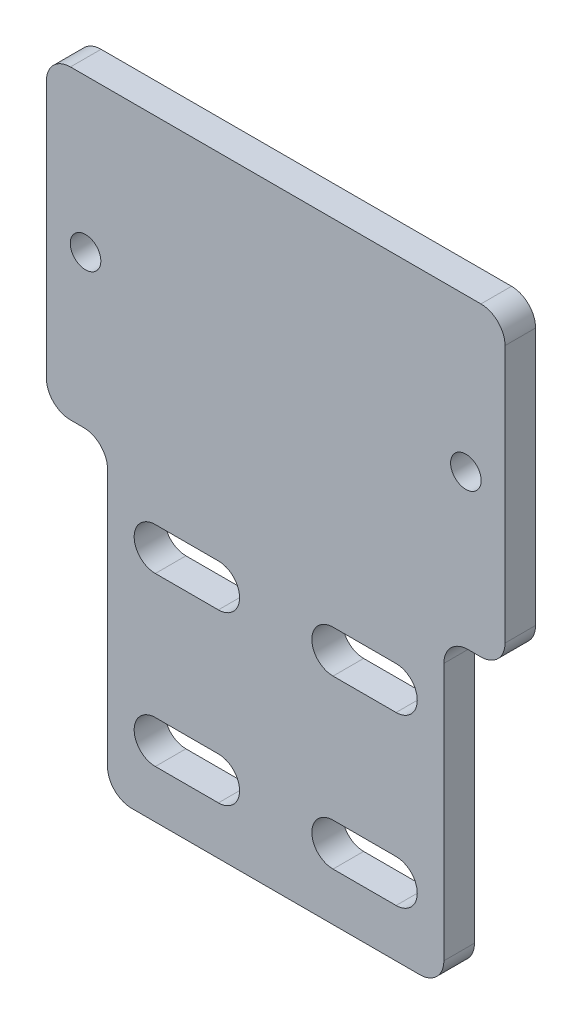
from build123d import *

# Parameters (mm, degrees)
BOSS_EXTRUDE1_DEPTH = 6.35
CUT_EXTRUDE1_REACH  = 153.604
SKETCH2_R           = 3.175
CUT_EXTRUDE2_REACH  = 153.604
FILLET1_R           = 5


with BuildPart() as part:
    # Sketch1 → Boss-Extrude1 (new body)
    with BuildSketch(Plane.XY):
        Polygon((0, 0), (0, 63.5), (-12.7, 63.5), (-12.7, 127), (82.55, 127), (82.55, 63.5), (69.85, 63.5), (69.85, 0), align=None)
    extrude(amount=BOSS_EXTRUDE1_DEPTH)

    # Sketch2 → Cut-Extrude1 (cut, up to next)
    with BuildSketch(Plane.XY.offset(6.35), mode=Mode.PRIVATE) as cut_extrude1_sk1:
        with Locations((-4.572, 95.25)):
            Circle(SKETCH2_R)
    cut_extrude1_tool1 = extrude(cut_extrude1_sk1.sketch, amount=-CUT_EXTRUDE1_REACH, mode=Mode.PRIVATE) & part.part
    # Sketch2 → Cut-Extrude1 (cut, up to next)
    with BuildSketch(Plane.XY.offset(6.35), mode=Mode.PRIVATE) as cut_extrude1_sk2:
        with Locations(Location((74.422, 95.25, 0), (0, 0, 180))):
            Circle(SKETCH2_R)
    cut_extrude1_tool2 = extrude(cut_extrude1_sk2.sketch, amount=-CUT_EXTRUDE1_REACH, mode=Mode.PRIVATE) & part.part
    add(cut_extrude1_tool1.solids().sort_by_distance((-4.572, 95.25, 6.35))[0], mode=Mode.SUBTRACT)
    add(cut_extrude1_tool2.solids().sort_by_distance((74.422, 95.25, 6.35))[0], mode=Mode.SUBTRACT)

    # Sketch3 → Cut-Extrude2 (cut, up to next)
    with BuildSketch(Plane.XY.offset(6.35), mode=Mode.PRIVATE) as cut_extrude2_sk1:
        with BuildLine():
            Line((9.925, 53.50542107), (23.01875, 53.50542107))
            ThreePointArc((23.01875, 53.50542107), (27.41875, 49.10542107), (23.01875, 44.70542107))
            Line((23.01875, 44.70542107), (9.925, 44.70542107))
            ThreePointArc((9.925, 44.70542107), (5.525, 49.10542107), (9.925, 53.50542107))
        make_face()
    cut_extrude2_tool1 = extrude(cut_extrude2_sk1.sketch, amount=-CUT_EXTRUDE2_REACH, mode=Mode.PRIVATE) & part.part
    # Sketch3 → Cut-Extrude2 (cut, up to next)
    with BuildSketch(Plane.XY.offset(6.35), mode=Mode.PRIVATE) as cut_extrude2_sk2:
        with BuildLine():
            Line((59.925, 53.50542107), (46.83125, 53.50542107))
            ThreePointArc((46.83125, 53.50542107), (42.43125, 49.10542107), (46.83125, 44.70542107))
            Line((46.83125, 44.70542107), (59.925, 44.70542107))
            ThreePointArc((59.925, 44.70542107), (64.325, 49.10542107), (59.925, 53.50542107))
        make_face()
    cut_extrude2_tool2 = extrude(cut_extrude2_sk2.sketch, amount=-CUT_EXTRUDE2_REACH, mode=Mode.PRIVATE) & part.part
    # Sketch3 → Cut-Extrude2 (cut, up to next)
    with BuildSketch(Plane.XY.offset(6.35), mode=Mode.PRIVATE) as cut_extrude2_sk3:
        with BuildLine():
            Line((59.925, 9.99457893), (46.83125, 9.99457893))
            ThreePointArc((46.83125, 9.99457893), (42.43125, 14.39457893), (46.83125, 18.79457893))
            Line((46.83125, 18.79457893), (59.925, 18.79457893))
            ThreePointArc((59.925, 18.79457893), (64.325, 14.39457893), (59.925, 9.99457893))
        make_face()
    cut_extrude2_tool3 = extrude(cut_extrude2_sk3.sketch, amount=-CUT_EXTRUDE2_REACH, mode=Mode.PRIVATE) & part.part
    # Sketch3 → Cut-Extrude2 (cut, up to next)
    with BuildSketch(Plane.XY.offset(6.35), mode=Mode.PRIVATE) as cut_extrude2_sk4:
        with BuildLine():
            Line((9.925, 9.99457893), (23.01875, 9.99457893))
            ThreePointArc((23.01875, 9.99457893), (27.41875, 14.39457893), (23.01875, 18.79457893))
            Line((23.01875, 18.79457893), (9.925, 18.79457893))
            ThreePointArc((9.925, 18.79457893), (5.525, 14.39457893), (9.925, 9.99457893))
        make_face()
    cut_extrude2_tool4 = extrude(cut_extrude2_sk4.sketch, amount=-CUT_EXTRUDE2_REACH, mode=Mode.PRIVATE) & part.part
    add(cut_extrude2_tool1.solids().sort_by_distance((16.471875, 49.105421, 6.35))[0], mode=Mode.SUBTRACT)
    add(cut_extrude2_tool2.solids().sort_by_distance((53.378125, 49.105421, 6.35))[0], mode=Mode.SUBTRACT)
    add(cut_extrude2_tool3.solids().sort_by_distance((53.378125, 14.394579, 6.35))[0], mode=Mode.SUBTRACT)
    add(cut_extrude2_tool4.solids().sort_by_distance((16.471875, 14.394579, 6.35))[0], mode=Mode.SUBTRACT)

    # Fillet1
    fillet1_edges = [part.edges().sort_by_distance(p)[0] for p in [
        (0, 0, 3.175),
        (0, 63.5, 3.175),
        (-12.7, 63.5, 3.175),
        (-12.7, 127, 3.175),
        (82.55, 127, 3.175),
        (82.55, 63.5, 3.175),
        (69.85, 63.5, 3.175),
        (69.85, 0, 3.175),
    ]]
    fillet(fillet1_edges, radius=FILLET1_R)


solid = part.part
